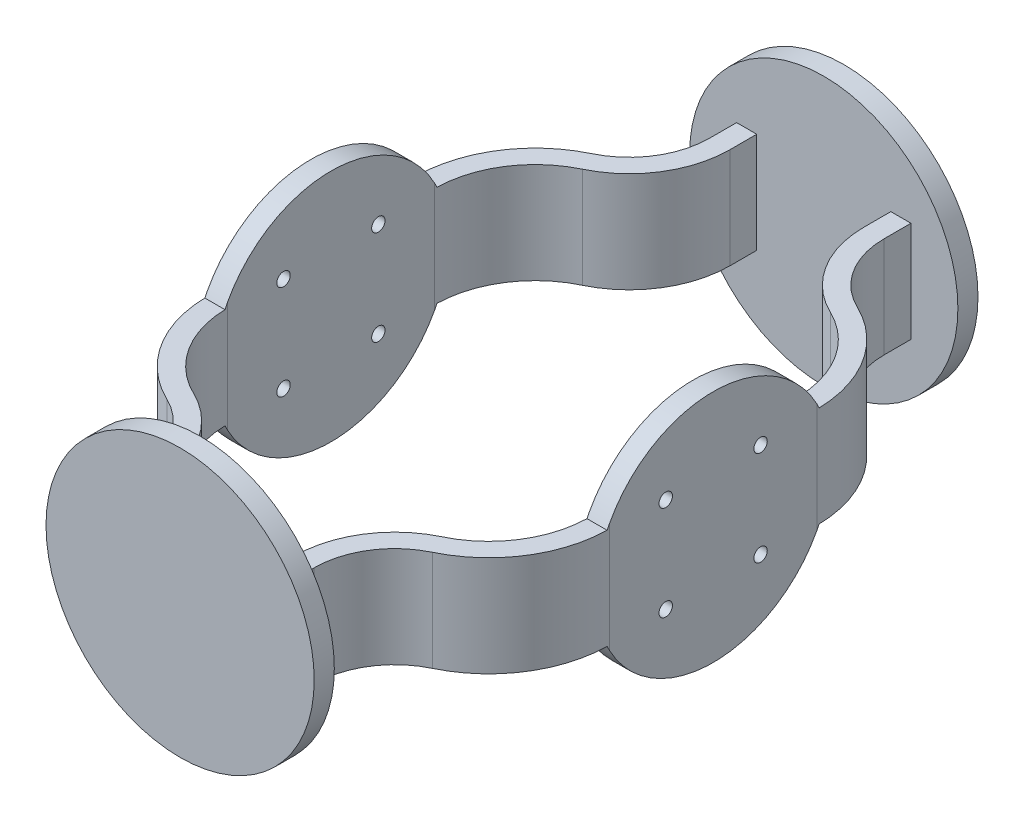
from build123d import *

# Parameters (mm, degrees)
BOSS_EXTRUDE1_DEPTH = 25
SKETCH2_R           = 1
BOSS_EXTRUDE2_DEPTH = 25
SKETCH3_R           = 20
BOSS_EXTRUDE3_DEPTH = 3


with BuildPart() as part:
    # Sketch1 → Boss-Extrude1 (new, symmetric)
    with BuildSketch(Plane(origin=(0, 0, 0), x_dir=(1, 0, 0), z_dir=(0, 1, 0))):
        with BuildLine():
            Line((-27, -15.462988331), (-27, 15.462988331))
            ThreePointArc((-27, 15.462988331), (-24.698425099, 23.447348042), (-18.5, 28.981494165))
            ThreePointArc((-18.5, 28.981494165), (-12.301574901, 34.515640289), (-10, 42.5))
            Line((-10, 42.5), (-10, 49.5))
            Line((-10, 49.5), (-13, 49.5))
            Line((-13, 49.5), (-13, 42.5))
            ThreePointArc((-13, 42.5), (-14.841259921, 36.112512231), (-19.8, 31.685195332))
            ThreePointArc((-19.8, 31.685195332), (-27.238110119, 25.044219984), (-30, 15.462988331))
            Line((-30, 15.462988331), (-30, -15.462988331))
            ThreePointArc((-30, -15.462988331), (-27.238110119, -25.044219984), (-19.8, -31.685195332))
            ThreePointArc((-19.8, -31.685195332), (-14.841259921, -36.112512231), (-13, -42.5))
            Line((-13, -42.5), (-13, -49.5))
            Line((-13, -49.5), (-10, -49.5))
            Line((-10, -49.5), (-10, -42.5))
            ThreePointArc((-10, -42.5), (-12.301574901, -34.515640289), (-18.5, -28.981494165))
            ThreePointArc((-18.5, -28.981494165), (-24.698425099, -23.447348042), (-27, -15.462988331))
        make_face()
    extrude(amount=BOSS_EXTRUDE1_DEPTH, both=True)


with BuildPart() as body_2:
    # Sketch2 → Boss-Extrude2 (new, symmetric)
    with BuildSketch(Plane(origin=(-27, 0, 0), x_dir=(0, 0, -1), z_dir=(1, 0, 0))):
        with BuildLine():
            Line((15.811388301, -7.5), (49.5, -7.5))
            Line((49.5, -7.5), (49.5, 7.5))
            Line((49.5, 7.5), (15.811388301, 7.5))
            ThreePointArc((15.811388301, 7.5), (0, 17.5), (-15.811388301, 7.5))
            Line((-15.811388301, 7.5), (-49.5, 7.5))
            Line((-49.5, 7.5), (-49.5, -7.5))
            Line((-49.5, -7.5), (-15.811388301, -7.5))
            ThreePointArc((-15.811388301, -7.5), (0, -17.5), (15.811388301, -7.5))
        make_face()
        with Locations((7.071067812, -7.071067812)):
            Circle(SKETCH2_R, mode=Mode.SUBTRACT)
        with Locations((-7.071067812, -7.071067812)):
            Circle(SKETCH2_R, mode=Mode.SUBTRACT)
        with Locations((-7.071067812, 7.071067812)):
            Circle(SKETCH2_R, mode=Mode.SUBTRACT)
        with Locations((7.071067812, 7.071067812)):
            Circle(SKETCH2_R, mode=Mode.SUBTRACT)
    extrude(amount=BOSS_EXTRUDE2_DEPTH, both=True)

    # Combine1: intersect part
    add(part.part, mode=Mode.INTERSECT)


with BuildPart() as body_2_2:
    # Mirror3: mirrored copy
    add(body_2.part.mirror(Plane(origin=(0, 0, 0), x_dir=(0, 0, 1), z_dir=(1, 0, 0))))


with BuildPart() as body_2_1:
    add(body_2.part)

    add(body_2_2.part)  # Boss-Extrude3 merges body 2 2
    # Sketch3 → Boss-Extrude3 (add)
    with BuildSketch(Plane(origin=(0, 0, -49.5), x_dir=(-1, 0, 0), z_dir=(0, 0, -1))):
        Circle(SKETCH3_R)
    boss_extrude3 = extrude(amount=-BOSS_EXTRUDE3_DEPTH)

    # Mirror4: Boss-Extrude3 across plane
    add(boss_extrude3.mirror(Plane.XY))


solid = body_2_1.part
